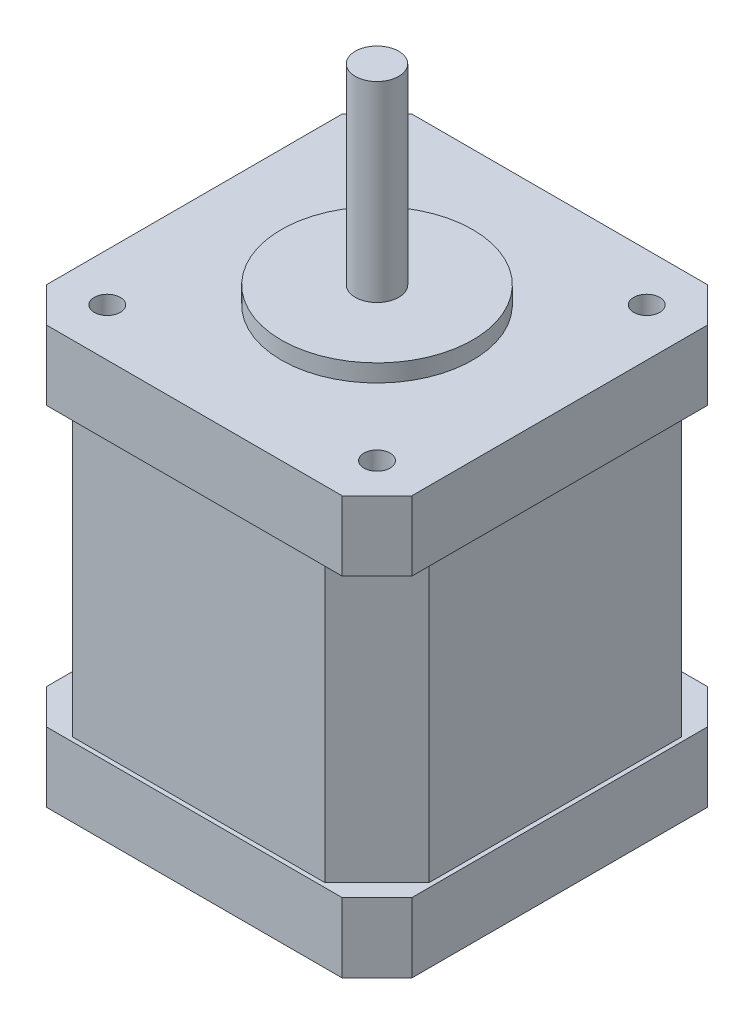
from build123d import *

# Parameters (mm, degrees)
SKETCH1_W           = 42
SKETCH1_H           = 42
BOSS_EXTRUDE1_DEPTH = 8
LPATTERN2_COUNT     = 2
LPATTERN2_PITCH     = 40
BOSS_EXTRUDE4_REACH = 51.82
SKETCH5_W           = 41
SKETCH5_H           = 41
CHAMFER2_SIZE       = 6
CHAMFER1_SIZE       = 4
SKETCH2_R           = 11
BOSS_EXTRUDE2_DEPTH = 2
SKETCH3_R           = 2.5
BOSS_EXTRUDE3_DEPTH = 22
SKETCH6_R           = 1.5
CUT_EXTRUDE1_DEPTH  = 7


with BuildPart() as part:
    # Sketch1 → Boss-Extrude1 (new body)
    with BuildSketch(Plane(origin=(0, 0, 0), x_dir=(1, 0, 0), z_dir=(0, 1, 0))):
        Rectangle(SKETCH1_W, SKETCH1_H)
    extrude(amount=BOSS_EXTRUDE1_DEPTH)


with BuildPart() as lpattern2_1:
    # LPattern2: pattern copy
    add(part.part.moved(Location(Vector(0, -1, 0) * (1 * LPATTERN2_PITCH))))

    # Sketch5 → Boss-Extrude4 (add, up to next)
    with BuildSketch(Plane.XZ, mode=Mode.PRIVATE) as boss_extrude4_sk1:
        Rectangle(SKETCH5_W, SKETCH5_H)
    boss_extrude4_tool1 = extrude(boss_extrude4_sk1.sketch, amount=BOSS_EXTRUDE4_REACH, mode=Mode.PRIVATE) - lpattern2_1.part

    add(part.part)  # Boss-Extrude4 merges part
    add(boss_extrude4_tool1.solids().sort_by_distance((0, 0, 0))[0])

    # Chamfer2
    chamfer2_edges = [lpattern2_1.edges().sort_by_distance(p)[0] for p in [
        (20.5, -16, 20.5),
        (-20.5, -16, 20.5),
        (-20.5, -16, -20.5),
        (20.5, -16, -20.5),
    ]]
    chamfer(chamfer2_edges, length=CHAMFER2_SIZE)

    # Chamfer1
    chamfer1_edges = [lpattern2_1.edges().sort_by_distance(p)[0] for p in [
        (-21, -36, -21),
        (-21, -36, 21),
        (21, -36, 21),
        (21, -36, -21),
        (-21, 4, -21),
        (21, 4, -21),
        (21, 4, 21),
        (-21, 4, 21),
    ]]
    chamfer(chamfer1_edges, length=CHAMFER1_SIZE)

    # Sketch2 → Boss-Extrude2 (add)
    with BuildSketch(Plane(origin=(0, 8, 0), x_dir=(1, 0, 0), z_dir=(0, 1, 0))):
        with Locations(Location((0, 0, 0), (0, 0, 270))):
            Circle(SKETCH2_R)
    extrude(amount=BOSS_EXTRUDE2_DEPTH)

    # Sketch3 → Boss-Extrude3 (add)
    with BuildSketch(Plane(origin=(0, 10, 0), x_dir=(1, 0, 0), z_dir=(0, 1, 0))):
        with Locations(Location((0, 0, 0), (0, 0, 270))):
            Circle(SKETCH3_R)
    extrude(amount=BOSS_EXTRUDE3_DEPTH)

    # Sketch6 → Cut-Extrude1 (cut)
    with BuildSketch(Plane(origin=(0, 8, 0), x_dir=(1, 0, 0), z_dir=(0, 1, 0))):
        with Locations(Location((-15.5, 15.5, 0), (0, 0, 270))):
            Circle(SKETCH6_R)
        with Locations(Location((15.5, 15.5, 0), (0, 0, 270))):
            Circle(SKETCH6_R)
        with Locations(Location((15.5, -15.5, 0), (0, 0, 270))):
            Circle(SKETCH6_R)
        with Locations(Location((-15.5, -15.5, 0), (0, 0, 270))):
            Circle(SKETCH6_R)
    extrude(amount=-CUT_EXTRUDE1_DEPTH, mode=Mode.SUBTRACT)


solid = lpattern2_1.part
